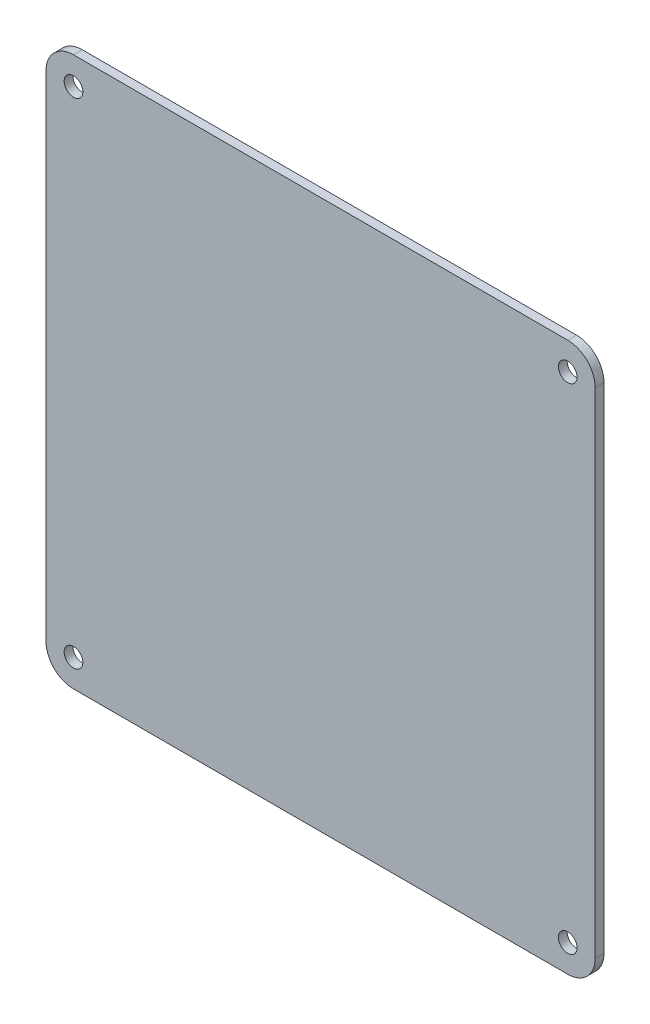
from build123d import *

# Parameters (mm, degrees)
BOSS_EXTRUDE1_DEPTH  = 1.6
M3_CLEARANCE_HOLE1_D = 3.4


with BuildPart() as part:
    # Sketch2 → Boss-Extrude1 (new body)
    with BuildSketch(Plane.XY):
        with BuildLine():
            Line((-45, 50), (45, 50))
            ThreePointArc((45, 50), (48.535533906, 48.535533906), (50, 45))
            Line((50, 45), (50, -45))
            ThreePointArc((50, -45), (48.535533906, -48.535533906), (45, -50))
            Line((45, -50), (-45, -50))
            ThreePointArc((-45, -50), (-48.535533906, -48.535533906), (-50, -45))
            Line((-50, -45), (-50, 45))
            ThreePointArc((-50, 45), (-48.535533906, 48.535533906), (-45, 50))
        make_face()
    extrude(amount=BOSS_EXTRUDE1_DEPTH)

    # M3 Clearance Hole1 (through all)
    with Locations(Plane.XY.offset(1.6)):
        with Locations((45, 45), (-45, 45), (-45, -45), (45, -45)):
            Hole(M3_CLEARANCE_HOLE1_D / 2)


solid = part.part
